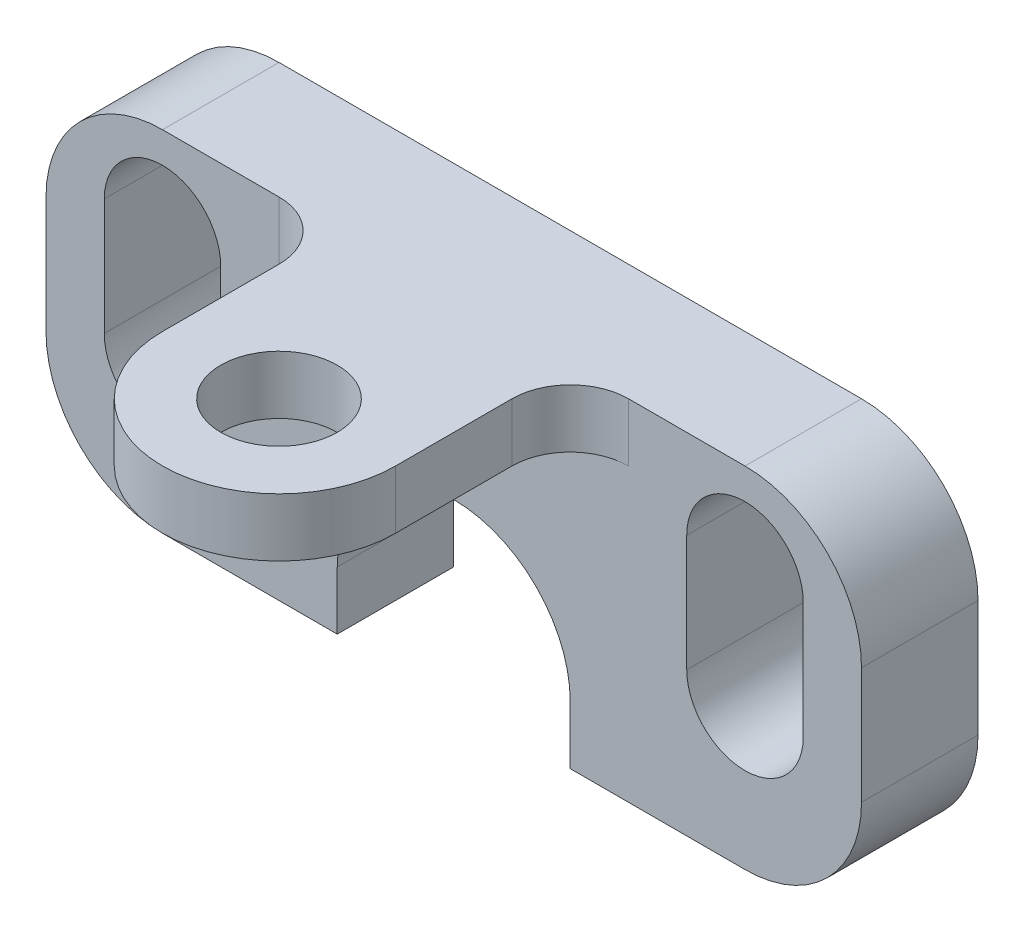
from build123d import *

# Parameters (mm, degrees)
BOSS_EXTRUDE1_DEPTH = 10
SKETCH2_W           = 20
SKETCH2_H           = 5
BOSS_EXTRUDE2_DEPTH = 15
FILLET3_R           = 5
FILLET4_R           = 5
BOSS_EXTRUDE4_DEPTH = 5
SKETCH4_R           = 5
CUT_EXTRUDE1_DEPTH  = 5


with BuildPart() as part:
    # Sketch1 → Boss-Extrude1 (new body)
    with BuildSketch(Plane.XY):
        with BuildLine():
            Line((-10, -15), (-10, -10))
            ThreePointArc((-10, -10), (0, 0), (10, -10))
            Line((10, -10), (10, -15))
            Line((10, -15), (25, -15))
            ThreePointArc((25, -15), (32.071067812, -12.071067812), (35, -5))
            Line((35, -5), (35, 5))
            ThreePointArc((35, 5), (32.071067812, 12.071067812), (25, 15))
            Line((25, 15), (-25, 15))
            ThreePointArc((-25, 15), (-32.071067812, 12.071067812), (-35, 5))
            Line((-35, 5), (-35, -5))
            ThreePointArc((-35, -5), (-32.071067812, -12.071067812), (-25, -15))
            Line((-25, -15), (-10, -15))
        make_face()
        with BuildLine():
            Line((30, 7.354167283), (30, -2.645832717))
            ThreePointArc((30, -2.645832717), (25, -7.645832717), (20, -2.645832717))
            Line((20, -2.645832717), (20, 7.354167283))
            ThreePointArc((20, 7.354167283), (25, 12.354167283), (30, 7.354167283))
        make_face(mode=Mode.SUBTRACT)
        with BuildLine():
            Line((-20, 7.354167283), (-20, -2.645832717))
            ThreePointArc((-20, -2.645832717), (-25, -7.645832717), (-30, -2.645832717))
            Line((-30, -2.645832717), (-30, 7.354167283))
            ThreePointArc((-30, 7.354167283), (-25, 12.354167283), (-20, 7.354167283))
        make_face(mode=Mode.SUBTRACT)
    extrude(amount=BOSS_EXTRUDE1_DEPTH)

    # Sketch2 → Boss-Extrude2 (add)
    with BuildSketch(Plane.XY.offset(10)):
        with Locations((0, 12.5)):
            Rectangle(SKETCH2_W, SKETCH2_H)
    extrude(amount=BOSS_EXTRUDE2_DEPTH)

    # Fillet3
    fillet3_edges = [part.edges().sort_by_distance(p)[0] for p in [
        (-10, 12.5, 10),
    ]]
    fillet(fillet3_edges, radius=FILLET3_R)

    # Fillet4
    fillet4_edges = [part.edges().sort_by_distance(p)[0] for p in [
        (10, 12.5, 10),
    ]]
    fillet(fillet4_edges, radius=FILLET4_R)

    # Sketch3 → Boss-Extrude4 (add)
    with BuildSketch(Plane(origin=(0, 15, 0), x_dir=(1, 0, 0), z_dir=(0, 1, 0))):
        with BuildLine():
            Line((-10, -25), (10, -25))
            ThreePointArc((10, -25), (0, -35), (-10, -25))
        make_face()
    extrude(amount=-BOSS_EXTRUDE4_DEPTH)

    # Sketch4 → Cut-Extrude1 (cut)
    with BuildSketch(Plane(origin=(0, 15, 0), x_dir=(1, 0, 0), z_dir=(0, 1, 0))):
        with Locations(Location((0, -25, 0), (0, 0, 270))):
            Circle(SKETCH4_R)
    extrude(amount=-CUT_EXTRUDE1_DEPTH, mode=Mode.SUBTRACT)


solid = part.part
